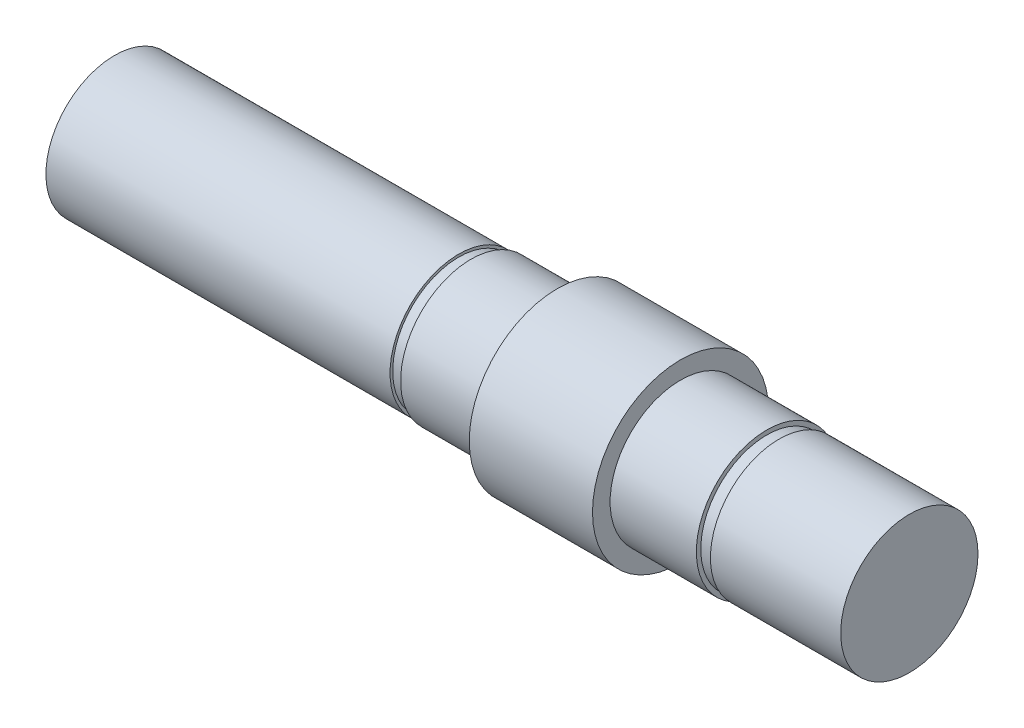
from build123d import *

# Parameters (mm, degrees)
CUT_EXTRUDE2_START = -45.15
CUT_EXTRUDE2_DEPTH = 18.85


with BuildPart() as part:
    # Sketch1 → Revolve1 (revolve)
    with BuildSketch(Plane.XY, mode=Mode.PRIVATE) as revolve1_sk:
        Polygon((0, 0), (-45.15, 0), (-45.15, 3.9), (-25.6, 3.9), (-25.6, 3.75), (-24.9, 3.75), (-24.9, 4), (-20, 4), (-20, 5), (-13, 5), (-13, 4), (-8.1, 4), (-8.1, 3.75), (-7.4, 3.75), (-7.4, 3.9), (0, 3.9), align=None)
    revolve(revolve1_sk.sketch.rotate(Axis((0, 0, 0), (-1, 0, 0)), 90), axis=Axis((0, 0, 0), (-1, 0, 0)))

    # Sketch2 → Cut-Extrude2 (cut)
    with BuildSketch(Plane(origin=(0, 0, 0), x_dir=(0, 0, -1), z_dir=(1, 0, 0)).offset(CUT_EXTRUDE2_START)):
        with BuildLine():
            Line((2, -3.348133809), (-2, -3.348133809))
            ThreePointArc((-2, -3.348133809), (0, -3.9), (2, -3.348133809))
        make_face()
    extrude(amount=CUT_EXTRUDE2_DEPTH, mode=Mode.SUBTRACT)


solid = part.part
